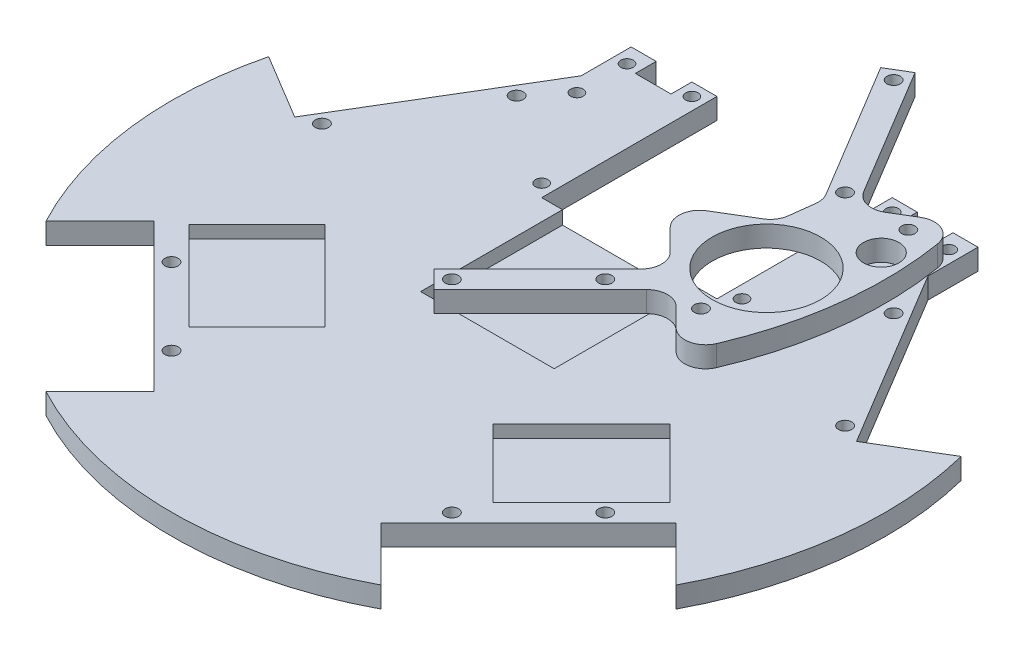
from build123d import *

# Parameters (mm, degrees)
EXTRUDE1_DEPTH  = 5
SKETCH3_W       = 42
SKETCH3_H       = 47
EXTRUDE2_DEPTH  = 5
SKETCH4_W       = 32
SKETCH4_H       = 40
EXTRUDE3_DEPTH  = 3.2
EXTRUDE4_DEPTH  = 3
SKETCH6_R       = 1.6
EXTRUDE5_DEPTH  = 5
SKETCH7_R       = 1.5
EXTRUDE6_DEPTH  = 5
SKETCH8_W       = 8.554171722
SKETCH8_H       = 7
EXTRUDE7_DEPTH  = 5
SKETCH9_R       = 1.5
EXTRUDE8_DEPTH  = 5
SKETCH10_R      = 1.6
EXTRUDE9_DEPTH  = 5
SKETCH14_R      = 4.25
EXTRUDE12_DEPTH = 5
SKETCH18_R      = 1.6
EXTRUDE16_DEPTH = 5
EXTRUDE18_DEPTH = 5
FILLET5_R       = 5
SKETCH23_R      = 1.6
EXTRUDE19_DEPTH = 5
SKETCH17_R      = 13
EXTRUDE20_DEPTH = 5


with BuildPart() as part:
    # Sketch2 → Extrude1 (new body)
    with BuildSketch(Plane(origin=(0, 0, 0), x_dir=(1, 0, 0), z_dir=(0, 1, 0))):
        with BuildLine():
            Line((82.960845984, 20.682070342), (67.306075467, 11.275735239))
            Line((67.306075467, 11.275735239), (41.554171722, 54.134100274))
            Line((41.554171722, 54.134100274), (41.554171722, 66.134100274))
            Line((41.554171722, 66.134100274), (-41.554171722, 66.134100274))
            Line((-41.554171722, 66.134100274), (-41.554171722, 54.134100274))
            Line((-41.554171722, 54.134100274), (-67.306075467, 11.275735239))
            Line((-67.306075467, 11.275735239), (-82.960845984, 20.682070342))
            ThreePointArc((-82.960845984, 20.682070342), (-84.862695965, -10.419828861), (-75.493108644, -40.137769585))
            Line((-75.493108644, -40.137769585), (-62.578950135, -27.223611076))
            Line((-62.578950135, -27.223611076), (-27.223611076, -62.578950135))
            Line((-27.223611076, -62.578950135), (-40.137769585, -75.493108644))
            ThreePointArc((-40.137769585, -75.493108644), (0, -85.5), (40.137769585, -75.493108644))
            Line((40.137769585, -75.493108644), (27.223611076, -62.578950135))
            Line((27.223611076, -62.578950135), (62.578950135, -27.223611076))
            Line((62.578950135, -27.223611076), (75.493108644, -40.137769585))
            ThreePointArc((75.493108644, -40.137769585), (84.862695965, -10.419828861), (82.960845984, 20.682070342))
        make_face()
    extrude(amount=-EXTRUDE1_DEPTH)

    # Sketch3 → Extrude2 (cut)
    with BuildSketch(Plane(origin=(0, 0, 0), x_dir=(1, 0, 0), z_dir=(0, 1, 0))):
        with Locations((0, 47.634100274)):
            Rectangle(SKETCH3_W, SKETCH3_H)
    extrude(amount=-EXTRUDE2_DEPTH, mode=Mode.SUBTRACT)

    # Sketch4 → Extrude3 (cut)
    with BuildSketch(Plane(origin=(0, 0, 0), x_dir=(-1, 0, 0), z_dir=(0, 1, 0))):
        with Locations((0, -10.134100274)):
            Rectangle(SKETCH4_W, SKETCH4_H)
    extrude(amount=-EXTRUDE3_DEPTH, mode=Mode.SUBTRACT)

    # Sketch5 → Extrude4 (cut)
    with BuildSketch(Plane(origin=(0, 0, 0), x_dir=(1, 0, 0), z_dir=(0, 1, 0))):
        Polygon((36.415999231, -44.901280605), (57.629202667, -23.68807717), (41.365746699, -7.424621202), (20.152543264, -28.637824638), align=None)
    extrude4 = extrude(amount=-EXTRUDE4_DEPTH, mode=Mode.SUBTRACT)

    # Mirror1: Extrude4 across plane
    add(extrude4.mirror(Plane(origin=(0, 0, 0), x_dir=(0, 0, 1), z_dir=(1, 0, 0))), mode=Mode.SUBTRACT)

    # Sketch6 → Extrude5 (cut)
    with BuildSketch(Plane(origin=(0, 0, 0), x_dir=(1, 0, 0), z_dir=(0, 1, 0))):
        with Locations(Location((45.163126719, 42.302978441, 0), (0, 0, 270))):
            Circle(SKETCH6_R)
        with Locations(Location((62.674421266, 13.159290217, 0), (0, 0, 270))):
            Circle(SKETCH6_R)
        with Locations(Location((51.972348417, -33.587572106, 0), (0, 0, 270))):
            Circle(SKETCH6_R)
        with Locations(Location((33.587572106, -51.972348417, 0), (0, 0, 270))):
            Circle(SKETCH6_R)
    extrude5 = extrude(amount=-EXTRUDE5_DEPTH, mode=Mode.SUBTRACT)

    # Mirror2: Extrude5 across plane
    add(extrude5.mirror(Plane(origin=(0, 0, 0), x_dir=(0, 0, 1), z_dir=(1, 0, 0))), mode=Mode.SUBTRACT)

    # Sketch7 → Extrude6 (cut)
    with BuildSketch(Plane(origin=(0, 0, 0), x_dir=(-1, 0, 0), z_dir=(0, 1, 0))):
        with Locations(Location((-24, -63.134100274, 0), (0, 0, 90))):
            Circle(SKETCH7_R)
        with Locations(Location((-24, -27.134100274, 0), (0, 0, 90))):
            Circle(SKETCH7_R)
    extrude6 = extrude(amount=-EXTRUDE6_DEPTH, mode=Mode.SUBTRACT)

    # Mirror3: Extrude6 across plane
    add(extrude6.mirror(Plane(origin=(0, 0, 0), x_dir=(0, 0, 1), z_dir=(1, 0, 0))), mode=Mode.SUBTRACT)

    # Sketch8 → Extrude7 (cut)
    with BuildSketch(Plane(origin=(0, 0, 0), x_dir=(1, 0, 0), z_dir=(0, 1, 0))):
        with Locations((31.277085861, 64.634100274)):
            Rectangle(SKETCH8_W, SKETCH8_H)
    extrude7 = extrude(amount=-EXTRUDE7_DEPTH, mode=Mode.SUBTRACT)

    # Mirror4: Extrude7 across plane
    add(extrude7.mirror(Plane(origin=(0, 0, 0), x_dir=(0, 0, 1), z_dir=(1, 0, 0))), mode=Mode.SUBTRACT)

    # Sketch9 → Extrude8 (cut)
    with BuildSketch(Plane(origin=(0, 0, 0), x_dir=(1, 0, 0), z_dir=(0, 1, 0))):
        with Locations(Location((38.554171722, 62.134100274, 0), (0, 0, 270))):
            Circle(SKETCH9_R)
        with Locations(Location((38.554171722, 50.134100274, 0), (0, 0, 270))):
            Circle(SKETCH9_R)
    extrude8 = extrude(amount=-EXTRUDE8_DEPTH, mode=Mode.SUBTRACT)

    # Mirror5: Extrude8 across plane
    add(extrude8.mirror(Plane(origin=(0, 0, 0), x_dir=(0, 0, 1), z_dir=(1, 0, 0))), mode=Mode.SUBTRACT)


with BuildPart() as body_2:
    # Sketch10 → Extrude9 (new body)
    with BuildSketch(Plane(origin=(0, 43.4, 0), x_dir=(-1, 0, 0), z_dir=(0, 1, 0))):
        with BuildLine():
            Line((-46.189514396, -46.419594568), (-41.046510592, -43.329366119))
            Line((-41.046510592, -43.329366119), (-61.648033588, -9.04267409))
            Line((-61.648033588, -9.04267409), (-57.629202667, 23.68807717))
            Line((-57.629202667, 23.68807717), (-29.344931419, 51.972348417))
            Line((-29.344931419, 51.972348417), (-33.587572106, 56.214989104))
            Line((-33.587572106, 56.214989104), (-62.578950135, 27.223611076))
            Line((-62.578950135, 27.223611076), (-75.493108644, 40.137769585))
            ThreePointArc((-75.493108644, 40.137769585), (-84.898228312, 10.424191685), (-82.960845984, -20.682070342))
            Line((-82.960845984, -20.682070342), (-67.306075467, -11.275735239))
            Line((-67.306075467, -11.275735239), (-46.189514396, -46.419594568))
        make_face()
        with Locations(Location((-45.163126719, -42.302978441, 0), (0, 0, 90))):
            Circle(SKETCH10_R, mode=Mode.SUBTRACT)
        with Locations(Location((-62.674421266, -13.159290217, 0), (0, 0, 90))):
            Circle(SKETCH10_R, mode=Mode.SUBTRACT)
        with Locations(Location((-51.972348417, 33.587572106, 0), (0, 0, 90))):
            Circle(SKETCH10_R, mode=Mode.SUBTRACT)
        with Locations(Location((-33.587572106, 51.972348417, 0), (0, 0, 90))):
            Circle(SKETCH10_R, mode=Mode.SUBTRACT)
    extrude(amount=EXTRUDE9_DEPTH)

    # Sketch14 → Extrude12 (cut)
    with BuildSketch(Plane(origin=(0, 48.4, 0), x_dir=(1, 0, 0), z_dir=(0, 1, 0))):
        with Locations(Location((79.5, 5, 0), (0, 0, 270))):
            Circle(SKETCH14_R)
    extrude(amount=-EXTRUDE12_DEPTH, mode=Mode.SUBTRACT)

    # Sketch18 → Extrude16 (cut)
    with BuildSketch(Plane(origin=(0, 48.4, 0), x_dir=(1, 0, 0), z_dir=(0, 1, 0))):
        with Locations(Location((78, 13, 0), (0, 0, 270))):
            Circle(SKETCH18_R)
    extrude(amount=-EXTRUDE16_DEPTH, mode=Mode.SUBTRACT)

    # Sketch21 → Extrude18 (add)
    with BuildSketch(Plane(origin=(0, 48.4, 0), x_dir=(1, 0, 0), z_dir=(0, 1, 0))):
        Polygon((57.629202667, -23.68807717), (44.434551522, -10.493426025), (60.429340154, -0.882787426), align=None)
    extrude(amount=-EXTRUDE18_DEPTH)

    # Fillet5
    fillet5_edges = [body_2.edges().sort_by_distance(p)[0] for p in [
        (67.306075467, 45.9, -11.275735239),
        (82.960845984, 45.9, -20.682070342),
        (75.493108644, 45.9, 40.137769585),
        (62.578950135, 45.9, 27.223611076),
        (57.629202667, 45.9, 23.68807717),
        (61.648033588, 45.9, -9.04267409),
        (44.434551522, 45.9, 10.493426025),
        (60.429340154, 45.9, 0.882787426),
    ]]
    fillet(fillet5_edges, radius=FILLET5_R)

    # Sketch23 → Extrude19 (cut)
    with BuildSketch(Plane(origin=(0, 48.4, 0), x_dir=(1, 0, 0), z_dir=(0, 1, 0))):
        with Locations(Location((69.5, -28.2, 0), (0, 0, 270))):
            Circle(SKETCH23_R)
    extrude(amount=-EXTRUDE19_DEPTH, mode=Mode.SUBTRACT)

    # Sketch17 → Extrude20 (cut)
    with BuildSketch(Plane(origin=(0, 48.4, 0), x_dir=(1, 0, 0), z_dir=(0, 1, 0))):
        with Locations(Location((69, -12, 0), (0, 0, 270))):
            Circle(SKETCH17_R)
    extrude(amount=-EXTRUDE20_DEPTH, mode=Mode.SUBTRACT)


solid = Compound([part.part, body_2.part])
